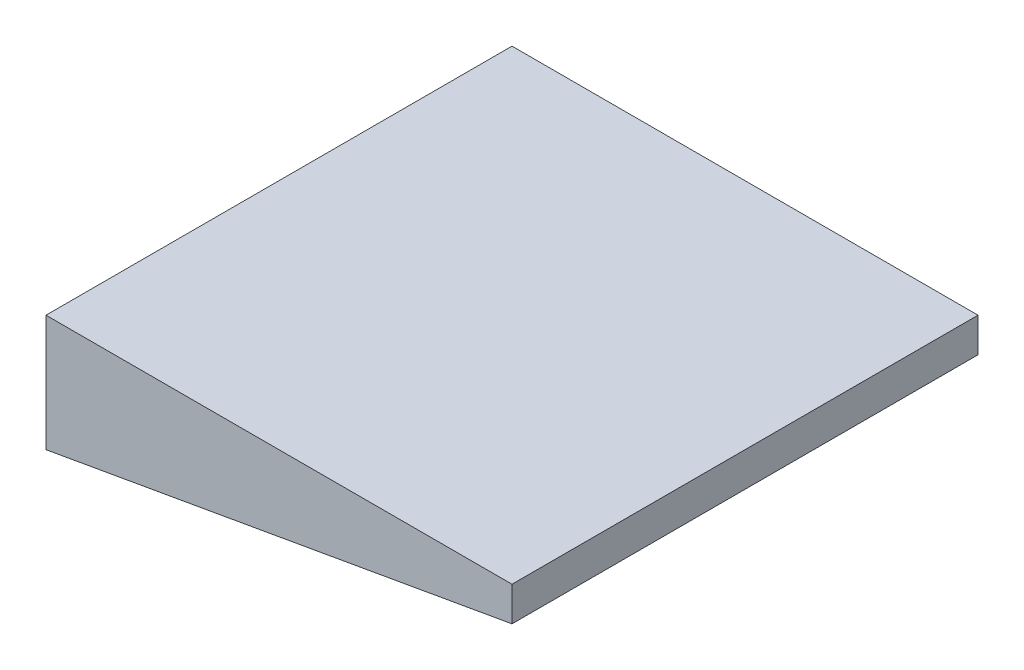
from build123d import *

# Parameters (mm, degrees)
SKETCH1_W           = 6.35
SKETCH1_H           = 6.35
BOSS_EXTRUDE1_DEPTH = 1.5875
CUT_EXTRUDE1_DEPTH  = 8.274838916


with BuildPart() as part:
    # Sketch1 → Boss-Extrude1 (new body)
    with BuildSketch(Plane(origin=(0, 0, 0), x_dir=(1, 0, 0), z_dir=(0, 1, 0))):
        Rectangle(SKETCH1_W, SKETCH1_H)
    extrude(amount=BOSS_EXTRUDE1_DEPTH)

    # Sketch2 → Cut-Extrude1 (cut, through all)
    with BuildSketch(Plane.XY.offset(3.175)):
        Polygon((-3.175, 0), (3.175, 1.119676327), (3.175, 0), align=None)
    extrude(amount=-CUT_EXTRUDE1_DEPTH, mode=Mode.SUBTRACT)


solid = part.part
